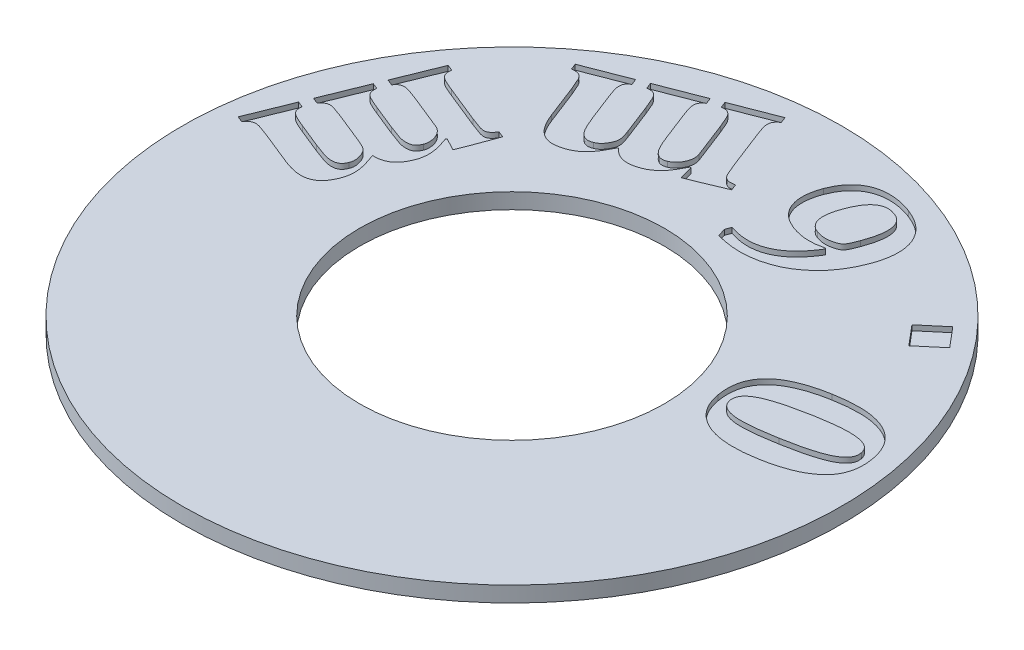
from build123d import *

# Parameters (mm, degrees)
SKETCH1_R           = 12.7
BOSS_EXTRUDE1_DEPTH = 0.6
SKETCH2_R           = 5.8674
CUT_EXTRUDE1_DEPTH  = 18.970531433
CUT_EXTRUDE2_DEPTH  = 0.2


with BuildPart() as part:
    # Sketch1 → Boss-Extrude1 (new body)
    with BuildSketch(Plane(origin=(0, 0, 0), x_dir=(1, 0, 0), z_dir=(0, 1, 0))):
        with Locations(Location((0, 0, 0), (0, 0, 270))):
            Circle(SKETCH1_R)
    extrude(amount=BOSS_EXTRUDE1_DEPTH)

    # Sketch2 → Cut-Extrude1 (cut, through all)
    with BuildSketch(Plane(origin=(0, 0, 0), x_dir=(-1, 0, 0), z_dir=(0, -1, 0))):
        with Locations(Location((0, 0, 0), (0, 0, 90))):
            Circle(SKETCH2_R)
    extrude(amount=-CUT_EXTRUDE1_DEPTH, mode=Mode.SUBTRACT)

    # Sketch4 → Cut-Extrude2 (cut)
    # profile 1 of 5: a face of its own
    with BuildSketch(Plane(origin=(0, 0.6, 0), x_dir=(1, 0, 0), z_dir=(0, 1, 0))):
        with BuildLine():
            add(Edge.make_bspline(
                [(11.714406882, 2.179505208), (11.721984598, 2.132914268), (11.736908331, 2.041156981), (11.74866318, 1.904864997), (11.752357826, 1.773036451), (11.746695803, 1.645600384), (11.733179819, 1.522296204), (11.707876126, 1.403581433), (11.676714797, 1.28899405), (11.635405668, 1.178658558), (11.584646929, 1.072709619), (11.523881673, 0.970485095), (11.450986751, 0.873052683), (11.368678714, 0.778083972), (11.274465946, 0.687951638), (11.170133167, 0.601476878), (11.055210203, 0.519203927), (10.930428021, 0.43948966), (10.794467406, 0.364166051), (10.646314632, 0.29538558), (10.487102545, 0.230047996), (10.316218188, 0.16993316), (10.134333462, 0.113455876), (9.940675548, 0.063162279), (9.735895278, 0.016742244), (9.594894738, -0.009651177), (9.522774937, -0.023151042)],
                knots=[0, 0, 0, 0, 0.958609587, 1.887908131, 2.776528707, 3.635817958, 4.477514347, 5.292981102, 6.098962166, 6.887927691, 7.682593858, 8.482745968, 9.299441865, 10.151273195, 11.03293693, 11.944771076, 12.90195535, 13.902185533, 14.951360626, 16.056714254, 17.218407893, 18.446172401, 19.735398079, 21.086155649, 22.509609453, 24, 24, 24, 24], degree=3))
            add(Edge.make_bspline(
                [(9.522774937, -0.023151042), (9.454127441, -0.034645174), (9.319705933, -0.05715231), (9.12075356, -0.082313288), (8.928870131, -0.100575903), (8.743451731, -0.10917171), (8.565078925, -0.110415714), (8.393576185, -0.104321059), (8.229124035, -0.088644407), (8.071591119, -0.065721648), (7.920831055, -0.035182887), (7.778159776, 0.00463669), (7.642571789, 0.051083117), (7.514219242, 0.104586405), (7.394291447, 0.168004545), (7.280576129, 0.23747752), (7.175347658, 0.315612752), (7.077398468, 0.400919375), (6.98835329, 0.493963148), (6.905829407, 0.592845125), (6.834554273, 0.700823489), (6.770493783, 0.814664857), (6.713621981, 0.934727323), (6.668112162, 1.062488935), (6.628452618, 1.196237051), (6.610486777, 1.288925244), (6.601333965, 1.336145833)],
                knots=[0, 0, 0, 0, 1.377081801, 2.696520979, 3.967029936, 5.189958886, 6.367899492, 7.495764028, 8.58392972, 9.634848915, 10.644458858, 11.625276047, 12.563445176, 13.479055366, 14.373430196, 15.245143787, 16.113332587, 16.963553947, 17.81203241, 18.65923255, 19.508240485, 20.36773861, 21.24275135, 22.132948981, 23.048818972, 24, 24, 24, 24], degree=3))
            add(Edge.make_bspline(
                [(6.601333965, 1.336145833), (6.590374917, 1.409119309), (6.569088165, 1.550862297), (6.561219532, 1.760415475), (6.575293668, 1.958953541), (6.610358421, 2.147139956), (6.667456922, 2.324628611), (6.748320425, 2.490485464), (6.849085657, 2.646203705), (6.972869034, 2.79037078), (7.119030215, 2.923495287), (7.287908697, 3.046015147), (7.479575957, 3.15799777), (7.692999529, 3.260534562), (7.929473846, 3.351911703), (8.188606749, 3.432493305), (8.469955143, 3.504792325), (8.666309681, 3.541772454), (8.767610007, 3.560850694)],
                knots=[0, 0, 0, 0, 0.999567856, 1.941551137, 2.835430862, 3.692112604, 4.530042397, 5.354256606, 6.185901446, 7.037296772, 7.922125271, 8.859554852, 9.859817352, 10.926857119, 12.065428116, 13.292532894, 14.603203662, 16, 16, 16, 16], degree=3))
            add(Edge.make_bspline(
                [(8.767610007, 3.560850694), (8.872556173, 3.578089573), (9.075950462, 3.611499934), (9.374044021, 3.642534882), (9.654962104, 3.655480481), (9.919104507, 3.649083388), (10.16646075, 3.625396611), (10.396947804, 3.584262386), (10.610223933, 3.523655106), (10.806244942, 3.444326865), (10.984715177, 3.347232526), (11.145299598, 3.232771229), (11.287704723, 3.100868546), (11.410870941, 2.950264084), (11.516398778, 2.782666511), (11.602055143, 2.597212453), (11.670170403, 2.3949462), (11.699387738, 2.252651608), (11.714406882, 2.179505208)],
                knots=[0, 0, 0, 0, 1.382354807, 2.679117153, 3.893664334, 5.035775843, 6.111018257, 7.121123013, 8.075237234, 8.98808331, 9.864605882, 10.710386895, 11.545304963, 12.380236698, 13.232482408, 14.113005489, 15.02999227, 16, 16, 16, 16], degree=3))
        make_face()
        with BuildLine():
            add(Edge.make_bspline(
                [(9.219606535, 1.068255208), (9.284683323, 1.079829663), (9.411704072, 1.102421373), (9.596640597, 1.138497503), (9.770534016, 1.176660884), (9.934053566, 1.212252427), (10.086559049, 1.249921426), (10.228376129, 1.288387015), (10.35990895, 1.327142151), (10.481497289, 1.365270741), (10.593486227, 1.40541221), (10.697010143, 1.445743704), (10.79215177, 1.48792763), (10.87901414, 1.530180936), (10.957341787, 1.574928103), (11.027127581, 1.620793229), (11.089596263, 1.666885144), (11.158879658, 1.728964171), (11.22971171, 1.810928632), (11.284648099, 1.922689244), (11.309871915, 2.043155021), (11.300339469, 2.123992073), (11.295483271, 2.165173611)],
                knots=[0, 0, 0, 0, 1.557617706, 3.040250939, 4.439806625, 5.752917555, 6.983694298, 8.141184335, 9.215338113, 10.214963335, 11.143493169, 12.018295842, 12.832493275, 13.595433329, 14.293601868, 14.956508562, 15.562688609, 16.120753321, 17.14746835, 18.092449204, 19.02821946, 20, 20, 20, 20], degree=3))
            add(Edge.make_bspline(
                [(11.295483271, 2.165173611), (11.290630428, 2.187423295), (11.281129519, 2.230983781), (11.255962542, 2.291754108), (11.225759764, 2.348181119), (11.184496682, 2.39690216), (11.137027399, 2.441883073), (11.0791213, 2.480383085), (11.013344364, 2.515872768), (10.937047568, 2.544976214), (10.851936991, 2.572052153), (10.75519068, 2.592541648), (10.647257078, 2.607613076), (10.527627319, 2.617369926), (10.395573233, 2.621273708), (10.249846914, 2.620975218), (10.090001592, 2.60947772), (9.916856706, 2.594438819), (9.731964111, 2.573380479), (9.53727306, 2.546553163), (9.33246291, 2.515932739), (9.193101759, 2.491778247), (9.121490215, 2.479366319)],
                knots=[0, 0, 0, 0, 0.572229672, 1.120312679, 1.650532829, 2.176538382, 2.719915381, 3.292219849, 3.921383417, 4.598328246, 5.344567867, 6.168499634, 7.084441038, 8.087164471, 9.188822549, 10.410175109, 11.7543557, 13.221963368, 14.786276719, 16.438938668, 18.170127758, 20, 20, 20, 20], degree=3))
            add(Edge.make_bspline(
                [(9.121490215, 2.479366319), (9.017037789, 2.459976007), (8.816564112, 2.422760526), (8.530215213, 2.362148612), (8.270747284, 2.301187922), (8.038791019, 2.23725447), (7.833636719, 2.172384552), (7.654402583, 2.108053279), (7.501513369, 2.042603377), (7.374408119, 1.975163143), (7.26992064, 1.906849976), (7.183532145, 1.838824888), (7.115875961, 1.768140381), (7.064031908, 1.69661103), (7.030638119, 1.621986877), (7.010354212, 1.545727996), (7.002907456, 1.466434944), (7.010030296, 1.413636803), (7.013642993, 1.386857639)],
                knots=[0, 0, 0, 0, 1.988775594, 3.817021521, 5.4789669, 6.977745736, 8.32016058, 9.506246951, 10.541465291, 11.430941948, 12.196080763, 12.876175374, 13.484416021, 14.022644376, 14.521394553, 15.005310829, 15.495494642, 16, 16, 16, 16], degree=3))
            add(Edge.make_bspline(
                [(7.013642993, 1.386857639), (7.020973001, 1.355992341), (7.03519293, 1.29611487), (7.075179093, 1.213190212), (7.129685771, 1.140706797), (7.200039193, 1.078925458), (7.285376056, 1.02810536), (7.385532945, 0.987763871), (7.500413136, 0.957375034), (7.629962099, 0.935883122), (7.775133078, 0.922664936), (7.93566621, 0.920645981), (8.111495262, 0.92477074), (8.302288999, 0.938796755), (8.508870696, 0.959906252), (8.731603074, 0.988816652), (8.970430894, 1.025365971), (9.134764463, 1.053651808), (9.219606535, 1.068255208)],
                knots=[0, 0, 0, 0, 0.626844687, 1.216054204, 1.808491308, 2.41169403, 3.058255876, 3.766476537, 4.543323699, 5.407210063, 6.364629713, 7.427452982, 8.585033063, 9.847165452, 11.215172558, 12.697471874, 14.294972063, 16, 16, 16, 16], degree=3))
        make_face(mode=Mode.SUBTRACT)
    # profile 2 of 5: a face of its own
    with BuildSketch(Plane(origin=(0, 0.6, 0), x_dir=(1, 0, 0), z_dir=(0, 1, 0))):
        Polygon((7.998334498, 7.413598887), (8.851615748, 8.134588471), (9.493230331, 7.375013818), (8.639949081, 6.654024235), align=None)
    # profile 3 of 5: a face of its own
    with BuildSketch(Plane(origin=(0, 0.6, 0), x_dir=(1, 0, 0), z_dir=(0, 1, 0))):
        with BuildLine():
            Line((1.200452366, 6.983777969), (1.280929797, 7.199854358))
            add(Edge.make_bspline(
                [(1.280929797, 7.199854358), (1.343817795, 7.179261353), (1.467155686, 7.138873713), (1.654011169, 7.098413309), (1.836977253, 7.07493453), (2.015597423, 7.068035969), (2.190562747, 7.078072145), (2.361694864, 7.104178741), (2.529159758, 7.148459834), (2.691452106, 7.211129672), (2.849876645, 7.288087424), (3.00262888, 7.382899312), (3.150358517, 7.492976917), (3.291751018, 7.620066885), (3.42880272, 7.760899591), (3.558935253, 7.919039208), (3.685331048, 8.091932582), (3.761884595, 8.216465585), (3.801086047, 8.280236302)],
                knots=[0, 0, 0, 0, 1.055048788, 2.0691944, 3.044229261, 3.994526873, 4.916374231, 5.835814113, 6.751508959, 7.673635849, 8.606948974, 9.557047682, 10.537179467, 11.541963796, 12.586653235, 13.668953384, 14.806320344, 16, 16, 16, 16], degree=3))
            Line((3.801086047, 8.280236302), (3.770217991, 8.307797066))
            add(Edge.make_bspline(
                [(3.770217991, 8.307797066), (3.71414798, 8.294562398), (3.604496336, 8.268680414), (3.440218512, 8.243045281), (3.280238818, 8.230703616), (3.12312468, 8.231653016), (2.966792107, 8.24638583), (2.809094217, 8.274242223), (2.648638057, 8.314787763), (2.542955388, 8.351804744), (2.489193686, 8.370635608)],
                knots=[0, 0, 0, 0, 1.05963004, 2.072233846, 3.055361679, 4.0086536, 4.959232627, 5.940685308, 6.95240852, 8, 8, 8, 8], degree=3))
            add(Edge.make_bspline(
                [(2.489193686, 8.370635608), (2.425678851, 8.396737335), (2.302249784, 8.447461105), (2.132920474, 8.545831273), (1.986886121, 8.662813599), (1.863257967, 8.795473288), (1.764751057, 8.943805026), (1.688468588, 9.103519705), (1.639308535, 9.275732636), (1.612688242, 9.457753868), (1.611225732, 9.648604645), (1.633351871, 9.846131474), (1.675600618, 10.050562667), (1.722178032, 10.185318726), (1.746155491, 10.254689427)],
                knots=[0, 0, 0, 0, 1.077595584, 2.094103196, 3.062986482, 4.006354381, 4.929902502, 5.848931818, 6.774838988, 7.731371815, 8.729829957, 9.762912156, 10.848375697, 12, 12, 12, 12], degree=3))
            add(Edge.make_bspline(
                [(1.746155491, 10.254689427), (1.7763527, 10.329017713), (1.835212514, 10.473896968), (1.951299256, 10.672660048), (2.085665588, 10.848945539), (2.213804547, 10.97741434), (2.326332688, 11.065860187), (2.414590439, 11.126148678), (2.508811454, 11.177493313), (2.606907441, 11.223070875), (2.710126865, 11.260830416), (2.818355474, 11.290046763), (2.930920772, 11.313549546), (3.048111242, 11.328816613), (3.169265694, 11.336319095), (3.294130713, 11.336644782), (3.422555278, 11.327106532), (3.55443731, 11.311041992), (3.689828281, 11.285147679), (3.828062677, 11.250881114), (3.970010998, 11.208775039), (4.064699677, 11.175620405), (4.113073894, 11.158682483)],
                knots=[0, 0, 0, 0, 1.672877526, 3.260740491, 4.787171376, 6.289516588, 7.032212332, 7.772527889, 8.517517252, 9.269110702, 10.028607479, 10.808285605, 11.607046719, 12.427139982, 13.272559756, 14.139283271, 15.03113053, 15.958707747, 16.910946222, 17.906201506, 18.93032764, 20, 20, 20, 20], degree=3))
            add(Edge.make_bspline(
                [(4.113073894, 11.158682483), (4.15697111, 11.141450954), (4.243422618, 11.107515052), (4.368170705, 11.050419534), (4.484996173, 10.987386071), (4.59493391, 10.920003123), (4.697245283, 10.847353308), (4.79277647, 10.769806838), (4.880831456, 10.687287685), (4.961582993, 10.600024174), (5.034609675, 10.508303615), (5.099779246, 10.41208411), (5.157520331, 10.31176066), (5.205939239, 10.20638206), (5.246771826, 10.09693552), (5.280219809, 9.983207721), (5.303980564, 9.864730901), (5.320880501, 9.742517717), (5.328043678, 9.616488704), (5.328305305, 9.48689334), (5.319416583, 9.353933132), (5.301199014, 9.21787529), (5.276088854, 9.078654194), (5.241524935, 8.936320611), (5.198718022, 8.790527437), (5.163826853, 8.693479882), (5.146051325, 8.644038385)],
                knots=[0, 0, 0, 0, 1.098191461, 2.162786548, 3.192832132, 4.188048845, 5.164054587, 6.113082797, 7.051594597, 7.972179555, 8.879742853, 9.779402692, 10.67641257, 11.572442019, 12.476973698, 13.395128669, 14.330043427, 15.288670823, 16.266176383, 17.267519822, 18.30535816, 19.36692158, 20.463110258, 21.598586896, 22.776584751, 24, 24, 24, 24], degree=3))
            add(Edge.make_bspline(
                [(5.146051325, 8.644038385), (5.120410458, 8.577547881), (5.069504659, 8.445541726), (4.979642143, 8.255748764), (4.882591907, 8.073477), (4.7757546, 7.901071263), (4.66050112, 7.736651354), (4.536347737, 7.581334242), (4.401952184, 7.435476143), (4.260695193, 7.298015339), (4.111468893, 7.171081941), (3.956153925, 7.054726669), (3.793202875, 6.951568523), (3.625965791, 6.857262903), (3.452169721, 6.775166977), (3.271848517, 6.706482366), (3.086418619, 6.645984938), (2.895066533, 6.599208672), (2.700286371, 6.564048118), (2.50372428, 6.540540621), (2.305560774, 6.530620344), (2.106360141, 6.534210416), (1.905755587, 6.549850704), (1.704278713, 6.57711169), (1.501495309, 6.618153508), (1.367468793, 6.65450437), (1.299671116, 6.672892552)],
                knots=[0, 0, 0, 0, 1.070823632, 2.125947334, 3.153976389, 4.173332704, 5.172465224, 6.170528418, 7.159609897, 8.15178657, 9.131336938, 10.102378564, 11.066150857, 12.028085339, 12.986779263, 13.952022445, 14.926733186, 15.916739616, 16.91025301, 17.90025944, 18.890219644, 19.890115268, 20.892859756, 21.913053768, 22.944312598, 24, 24, 24, 24], degree=3))
            Line((1.299671116, 6.672892552), (1.200452366, 6.983777969))
        make_face()
        with BuildLine():
            add(Edge.make_bspline(
                [(3.076789172, 8.698057483), (3.132909456, 8.679932439), (3.243010075, 8.644373488), (3.413032857, 8.625283629), (3.576075832, 8.63331494), (3.704133547, 8.658205157), (3.795432605, 8.686357261), (3.852529709, 8.707316756), (3.898519111, 8.728016151), (3.948692476, 8.75488002), (4.001805532, 8.805818747), (4.047266948, 8.872729684), (4.084461884, 8.946478634), (4.119923668, 9.023856133), (4.158569665, 9.121872517), (4.186258552, 9.19376456), (4.201268339, 9.232736302)],
                knots=[0, 0, 0, 0, 1.710541778, 3.355858038, 4.938271646, 6.440062148, 7.13262002, 7.713873542, 8.206199276, 8.598318393, 9.361997601, 10.313061428, 10.938824559, 11.760841173, 12.786181087, 14, 14, 14, 14], degree=3))
            add(Edge.make_bspline(
                [(4.201268339, 9.232736302), (4.219616657, 9.284432015), (4.255072374, 9.384327197), (4.30105685, 9.531510269), (4.335960436, 9.671161482), (4.362974871, 9.803145166), (4.381080853, 9.927152769), (4.388903885, 10.043638718), (4.388039482, 10.152006568), (4.378848483, 10.252989558), (4.358648581, 10.346021304), (4.330820471, 10.43180026), (4.290949714, 10.508625418), (4.24422561, 10.579514316), (4.184064175, 10.639885789), (4.116891173, 10.694879513), (4.038769365, 10.7401109), (3.982187335, 10.763211055), (3.953221464, 10.775036649)],
                knots=[0, 0, 0, 0, 1.500894568, 2.900281813, 4.217152542, 5.437764563, 6.585289063, 7.643385764, 8.628806701, 9.548256839, 10.412033135, 11.229197673, 12.007129352, 12.774066827, 13.542058149, 14.328777375, 15.144455933, 16, 16, 16, 16], degree=3))
            add(Edge.make_bspline(
                [(3.953221464, 10.775036649), (3.919245977, 10.786364872), (3.853943728, 10.80813817), (3.75608292, 10.828911875), (3.662442482, 10.834694319), (3.573482634, 10.826592591), (3.488865702, 10.807977138), (3.408458099, 10.777657234), (3.332269753, 10.736631897), (3.260047544, 10.685155263), (3.191439608, 10.624053207), (3.126309215, 10.552989981), (3.064446481, 10.472120724), (2.985796284, 10.348662157), (2.892809985, 10.174619164), (2.834135004, 10.024617309), (2.803386394, 9.946008871)],
                knots=[0, 0, 0, 0, 0.932873925, 1.793021151, 2.598839487, 3.367856657, 4.113627244, 4.849993345, 5.599749579, 6.36230028, 7.155964143, 7.989527263, 8.87058289, 9.805567893, 11.801908814, 14, 14, 14, 14], degree=3))
            add(Edge.make_bspline(
                [(2.803386394, 9.946008871), (2.789021343, 9.905717802), (2.761142699, 9.82752383), (2.727163126, 9.711565588), (2.69985937, 9.601384176), (2.682829992, 9.496212874), (2.670852833, 9.39695612), (2.668292805, 9.303160591), (2.675472645, 9.215066626), (2.688060026, 9.132630092), (2.708521729, 9.055609287), (2.739278462, 8.985918652), (2.775041981, 8.920834938), (2.820963864, 8.863655968), (2.873499986, 8.812178352), (2.933526127, 8.766434912), (3.002012742, 8.728007435), (3.051553194, 8.708165164), (3.076789172, 8.698057483)],
                knots=[0, 0, 0, 0, 1.424088551, 2.763767271, 4.022183305, 5.201039714, 6.30911801, 7.349523498, 8.319005133, 9.248428938, 10.124185317, 10.962911168, 11.779474492, 12.589779123, 13.394520957, 14.224182145, 15.095395788, 16, 16, 16, 16], degree=3))
        make_face(mode=Mode.SUBTRACT)
    # profile 4 of 5: a face of its own
    with BuildSketch(Plane(origin=(0, 0.6, 0), x_dir=(1, 0, 0), z_dir=(0, 1, 0))):
        with BuildLine():
            Line((-1.500499582, 8.398806621), (-1.545699235, 8.394396899))
            add(Edge.make_bspline(
                [(-1.545699235, 8.394396899), (-1.578680129, 8.328177935), (-1.64156419, 8.201919461), (-1.744030648, 8.02884167), (-1.846044886, 7.880084841), (-1.949946333, 7.754727011), (-2.05857315, 7.650318657), (-2.17357881, 7.562688436), (-2.294646542, 7.48709386), (-2.38188138, 7.450331118), (-2.425438818, 7.431975024)],
                knots=[0, 0, 0, 0, 1.327248858, 2.530640849, 3.606312378, 4.561298934, 5.447501221, 6.30354898, 7.15294094, 8, 8, 8, 8], degree=3))
            add(Edge.make_bspline(
                [(-2.425438818, 7.431975024), (-2.466711164, 7.416501822), (-2.546064862, 7.386751738), (-2.664025189, 7.356362389), (-2.774202536, 7.336715383), (-2.877415506, 7.329477021), (-2.975012839, 7.335492968), (-3.068194376, 7.350780271), (-3.158059284, 7.376341345), (-3.244768044, 7.411813357), (-3.328951411, 7.458526601), (-3.408552551, 7.519497131), (-3.489562903, 7.588502591), (-3.538054885, 7.643001758), (-3.563147151, 7.671202454)],
                knots=[0, 0, 0, 0, 1.261849166, 2.426137807, 3.483538902, 4.464561663, 5.381899843, 6.278343648, 7.164718223, 8.052217243, 8.957088943, 9.91293841, 10.920046081, 12, 12, 12, 12], degree=3))
            add(Edge.make_bspline(
                [(-3.563147151, 7.671202454), (-3.599531182, 7.59843004), (-3.668389116, 7.460705936), (-3.777147706, 7.27123298), (-3.885029972, 7.111206789), (-3.99057811, 6.976050247), (-4.102053829, 6.86480688), (-4.219976724, 6.770641123), (-4.348199055, 6.69203994), (-4.439779694, 6.652578048), (-4.485881526, 6.632712871)],
                knots=[0, 0, 0, 0, 1.370148351, 2.593049264, 3.676206861, 4.618613109, 5.476374145, 6.322127868, 7.155356622, 8, 8, 8, 8], degree=3))
            add(Edge.make_bspline(
                [(-4.485881526, 6.632712871), (-4.530445251, 6.616076964), (-4.615952839, 6.584156465), (-4.743101562, 6.551526654), (-4.861772979, 6.530294812), (-4.973189572, 6.524827778), (-5.078684173, 6.531644554), (-5.178538203, 6.555233414), (-5.275449977, 6.587065021), (-5.366578661, 6.635862424), (-5.452894115, 6.696968271), (-5.534744327, 6.770753064), (-5.613569564, 6.855921676), (-5.687290851, 6.95508305), (-5.757960734, 7.067347228), (-5.826043906, 7.19293182), (-5.891036555, 7.332819596), (-5.93122393, 7.431428083), (-5.952114165, 7.482686829)],
                knots=[0, 0, 0, 0, 1.164238848, 2.233907847, 3.210467445, 4.111618036, 4.95998529, 5.789768502, 6.618037198, 7.451375979, 8.310370773, 9.20280479, 10.145472204, 11.148103074, 12.224265042, 13.392220349, 14.64442181, 16, 16, 16, 16], degree=3))
            Line((-5.952114165, 7.482686829), (-6.443798193, 8.752686829))
            add(Edge.make_bspline(
                [(-6.443798193, 8.752686829), (-6.46298886, 8.80204742), (-6.500138469, 8.897600464), (-6.557518406, 9.031550001), (-6.610596713, 9.14701544), (-6.6652213, 9.236719574), (-6.719195792, 9.30301382), (-6.776882541, 9.349899558), (-6.841998121, 9.381410269), (-6.91741995, 9.396764093), (-7.003583166, 9.400735532), (-7.06413052, 9.395102303), (-7.096437082, 9.392096552)],
                knots=[0, 0, 0, 0, 1.559140996, 3.018210822, 4.290952874, 5.296787436, 6.103062558, 6.795868098, 7.468525882, 8.211398264, 9.045646607, 10, 10, 10, 10], degree=3))
            Line((-7.096437082, 9.392096552), (-7.185733957, 9.621402107))
            Line((-7.185733957, 9.621402107), (-5.508937082, 10.271836135))
            Line((-5.508937082, 10.271836135), (-5.419640207, 10.042530579))
            add(Edge.make_bspline(
                [(-5.419640207, 10.042530579), (-5.44126826, 10.026399982), (-5.481650493, 9.996282175), (-5.533846741, 9.947929725), (-5.570951767, 9.898212078), (-5.594627254, 9.847372575), (-5.604920024, 9.794555745), (-5.609329846, 9.738344691), (-5.607052869, 9.676900081), (-5.596124222, 9.607106489), (-5.574701737, 9.523170129), (-5.540686924, 9.418742082), (-5.495430219, 9.289738424), (-5.459929128, 9.196145913), (-5.440586387, 9.145152107)],
                knots=[0, 0, 0, 0, 0.976263073, 1.822803084, 2.564919562, 3.207680077, 3.833713685, 4.500778585, 5.245986733, 6.052842077, 7.052732165, 8.377616694, 10.026347317, 12, 12, 12, 12], degree=3))
            Line((-5.440586387, 9.145152107), (-5.077886735, 8.212495857))
            add(Edge.make_bspline(
                [(-5.077886735, 8.212495857), (-5.058213378, 8.162818328), (-5.020773209, 8.068277516), (-4.964958774, 7.935032266), (-4.911566849, 7.817607376), (-4.862407323, 7.714442109), (-4.814206633, 7.625009471), (-4.764214553, 7.549826783), (-4.714948421, 7.485912263), (-4.663879121, 7.434812521), (-4.612373766, 7.394089192), (-4.560879865, 7.363706829), (-4.510177119, 7.340304693), (-4.45834347, 7.326789669), (-4.404290481, 7.322415505), (-4.347102358, 7.327322637), (-4.286499427, 7.340839251), (-4.245784961, 7.355102318), (-4.224605485, 7.362521899)],
                knots=[0, 0, 0, 0, 1.886072366, 3.589365554, 5.098767554, 6.438935382, 7.62327005, 8.680997452, 9.623029443, 10.466885591, 11.224590498, 11.934248244, 12.573028465, 13.189694188, 13.814492117, 14.478078476, 15.208303495, 16, 16, 16, 16], degree=3))
            add(Edge.make_bspline(
                [(-4.224605485, 7.362521899), (-4.196124879, 7.375107043), (-4.140617846, 7.399634753), (-4.06647594, 7.453951996), (-4.002096369, 7.521299194), (-3.946506985, 7.600529328), (-3.897145713, 7.683379182), (-3.857845601, 7.766968153), (-3.829112457, 7.850147785), (-3.819086508, 7.936966256), (-3.820853325, 8.026934807), (-3.836167036, 8.105507556), (-3.855045624, 8.176985637), (-3.877649694, 8.244743013), (-3.906253353, 8.326857924), (-3.92895999, 8.385647919), (-3.941280832, 8.41754794)],
                knots=[0, 0, 0, 0, 1.05712718, 2.060278967, 3.103930472, 4.214663213, 5.347149753, 6.382223774, 7.355140304, 8.326206341, 9.339519046, 10.406659634, 11.040664636, 11.855394827, 12.836316401, 14, 14, 14, 14], degree=3))
            Line((-3.941280832, 8.41754794), (-4.381150624, 9.551948982))
            add(Edge.make_bspline(
                [(-4.381150624, 9.551948982), (-4.395843684, 9.589066049), (-4.42322045, 9.65822422), (-4.461713942, 9.755215287), (-4.496936471, 9.837422587), (-4.535923805, 9.924848545), (-4.581174005, 10.013011645), (-4.639853073, 10.097027896), (-4.70584835, 10.158300648), (-4.770957186, 10.189348355), (-4.82925529, 10.203846904), (-4.881158179, 10.209027832), (-4.940539071, 10.208514609), (-4.982726237, 10.205229651), (-5.005126318, 10.20348544)],
                knots=[0, 0, 0, 0, 1.43593228, 2.675492938, 3.753329024, 4.652559938, 6.11901344, 7.311444819, 8.322447917, 9.321542641, 9.866545793, 10.478167495, 11.191953967, 12, 12, 12, 12], degree=3))
            Line((-5.005126318, 10.20348544), (-5.094423193, 10.432790996))
            Line((-5.094423193, 10.432790996), (-3.438572499, 11.074405579))
            Line((-3.438572499, 11.074405579), (-3.349275624, 10.845100024))
            add(Edge.make_bspline(
                [(-3.349275624, 10.845100024), (-3.371829284, 10.829185098), (-3.413734166, 10.799615038), (-3.465251913, 10.749034653), (-3.503876703, 10.69980329), (-3.528520914, 10.648919497), (-3.540482433, 10.595811986), (-3.544340482, 10.539416273), (-3.542185737, 10.47838512), (-3.531505961, 10.409501208), (-3.508063178, 10.326746257), (-3.474739068, 10.222065038), (-3.429638126, 10.092106636), (-3.393324208, 9.997946719), (-3.373529096, 9.946619121)],
                knots=[0, 0, 0, 0, 0.992957471, 1.844922954, 2.591631667, 3.237113429, 3.86329802, 4.54058269, 5.269232777, 6.059395145, 7.045266299, 8.364235463, 10.018105088, 12, 12, 12, 12], degree=3))
            Line((-3.373529096, 9.946619121), (-3.010829443, 9.013962871))
            add(Edge.make_bspline(
                [(-3.010829443, 9.013962871), (-2.996657788, 8.977151092), (-2.969516159, 8.906648973), (-2.928004225, 8.806398578), (-2.891454916, 8.714556702), (-2.844654724, 8.610739499), (-2.791764113, 8.500780224), (-2.730333993, 8.390242101), (-2.666711658, 8.305624809), (-2.604799685, 8.236574129), (-2.538315851, 8.186697449), (-2.473039115, 8.148601797), (-2.403922676, 8.128561555), (-2.329787806, 8.121444181), (-2.246708712, 8.132336889), (-2.1910254, 8.152150967), (-2.160855485, 8.162886482)],
                knots=[0, 0, 0, 0, 1.218376668, 2.33344156, 3.351562828, 4.271279059, 5.850097088, 7.121466675, 8.168044415, 9.115705124, 9.973893436, 10.725810247, 11.436861629, 12.177817345, 13.012718608, 14, 14, 14, 14], degree=3))
            add(Edge.make_bspline(
                [(-2.160855485, 8.162886482), (-2.139651487, 8.17267279), (-2.096037015, 8.192802233), (-2.034047516, 8.233544001), (-1.97680789, 8.28717359), (-1.920611109, 8.347803533), (-1.870920225, 8.417558281), (-1.828079155, 8.49341736), (-1.795216046, 8.575437602), (-1.771331247, 8.661942034), (-1.756280888, 8.749896331), (-1.755281747, 8.83758026), (-1.766801807, 8.92340652), (-1.78547311, 8.977820506), (-1.79484854, 9.005143427)],
                knots=[0, 0, 0, 0, 0.836243377, 1.720067758, 2.64304706, 3.640427864, 4.67827718, 5.704026804, 6.755486752, 7.835339964, 8.915594534, 9.942780013, 10.967007125, 12, 12, 12, 12], degree=3))
            Line((-1.79484854, 9.005143427), (-2.317400624, 10.352313565))
            add(Edge.make_bspline(
                [(-2.317400624, 10.352313565), (-2.337449883, 10.40272207), (-2.374297839, 10.495366407), (-2.426816724, 10.620893065), (-2.471793057, 10.720796935), (-2.510807835, 10.798084427), (-2.54947846, 10.857414013), (-2.587241421, 10.906814316), (-2.629873376, 10.945553523), (-2.675175925, 10.977219168), (-2.728120542, 10.998709343), (-2.789785301, 11.010093904), (-2.861054931, 11.0134522), (-2.911278956, 11.00790917), (-2.938069026, 11.004952454)],
                knots=[0, 0, 0, 0, 1.95560344, 3.594147164, 4.904245662, 5.905587673, 6.710271926, 7.455046029, 8.139409163, 8.778697916, 9.437986146, 10.180991047, 11.02971977, 12, 12, 12, 12], degree=3))
            Line((-2.938069026, 11.004952454), (-3.027365901, 11.23425801))
            Line((-3.027365901, 11.23425801), (-1.360490901, 11.880282315))
            Line((-1.360490901, 11.880282315), (-1.271194026, 11.65097676))
            add(Edge.make_bspline(
                [(-1.271194026, 11.65097676), (-1.294464177, 11.633544837), (-1.337723243, 11.601139), (-1.391337788, 11.547318124), (-1.431986317, 11.49598486), (-1.45922466, 11.443955182), (-1.473163029, 11.3904295), (-1.479948266, 11.334042404), (-1.478351478, 11.2732882), (-1.469043519, 11.204391579), (-1.446753676, 11.121913989), (-1.414774149, 11.018105936), (-1.368617134, 10.890236847), (-1.333428141, 10.796908086), (-1.314188818, 10.745881274)],
                knots=[0, 0, 0, 0, 1.037135948, 1.928029266, 2.705015774, 3.368269828, 4.008263075, 4.669175765, 5.391120458, 6.172527977, 7.146544743, 8.437585155, 10.052275959, 12, 12, 12, 12], degree=3))
            Line((-1.314188818, 10.745881274), (-0.759666249, 9.316028843))
            add(Edge.make_bspline(
                [(-0.759666249, 9.316028843), (-0.743921112, 9.275951927), (-0.714551879, 9.201196888), (-0.672985784, 9.097792191), (-0.636647661, 9.011772902), (-0.597587967, 8.923591054), (-0.551084166, 8.837162329), (-0.490114353, 8.754815403), (-0.417614899, 8.699473063), (-0.347881536, 8.672373402), (-0.282522669, 8.66399496), (-0.221567487, 8.665129956), (-0.1486079, 8.670552639), (-0.096688113, 8.678765615), (-0.06844229, 8.683233704)],
                knots=[0, 0, 0, 0, 1.450579982, 2.705751189, 3.754223165, 4.596399602, 5.953928095, 7.055990142, 8.019135306, 8.987042258, 9.536785458, 10.230042737, 11.037093544, 12, 12, 12, 12], degree=3))
            Line((-0.06844229, 8.683233704), (0.023059446, 8.446211135))
            Line((0.023059446, 8.446211135), (-0.919518679, 8.048233704))
            Line((-0.919518679, 8.048233704), (-1.35828604, 7.878459399))
            Line((-1.35828604, 7.878459399), (-1.500499582, 8.398806621))
        make_face()
    # profile 5 of 5: a face of its own
    with BuildSketch(Plane(origin=(0, 0.6, 0), x_dir=(1, 0, 0), z_dir=(0, 1, 0))):
        with BuildLine():
            Line((-7.16368149, 4.664663168), (-7.190139823, 4.626078099))
            add(Edge.make_bspline(
                [(-7.190139823, 4.626078099), (-7.164649314, 4.55729115), (-7.116159018, 4.42643855), (-7.060406274, 4.234988301), (-7.023567353, 4.059884896), (-7.00352064, 3.899037183), (-7.001186545, 3.748971413), (-7.014304824, 3.605121185), (-7.043445696, 3.465714205), (-7.075877359, 3.377062447), (-7.092023504, 3.332927057)],
                knots=[0, 0, 0, 0, 1.323655474, 2.517974168, 3.594956346, 4.550030047, 5.438835311, 6.298074595, 7.15269428, 8, 8, 8, 8], degree=3))
            add(Edge.make_bspline(
                [(-7.092023504, 3.332927057), (-7.109391964, 3.292567879), (-7.142627793, 3.215337616), (-7.200539997, 3.109008476), (-7.260487173, 3.015474937), (-7.326239511, 2.936063699), (-7.396981172, 2.869399843), (-7.470867554, 2.811013651), (-7.551013684, 2.763937143), (-7.6355474, 2.724328503), (-7.72676892, 2.695727303), (-7.825186481, 2.677359214), (-7.930758256, 2.667037872), (-8.00371313, 2.668508086), (-8.041216212, 2.669263863)],
                knots=[0, 0, 0, 0, 1.263710982, 2.418204165, 3.479912074, 4.456078823, 5.37604635, 6.272872525, 7.159668175, 8.044444074, 8.954083143, 9.901829511, 10.921417382, 12, 12, 12, 12], degree=3))
            add(Edge.make_bspline(
                [(-8.041216212, 2.669263863), (-8.012664087, 2.593533847), (-7.958672874, 2.450330655), (-7.897254148, 2.242338044), (-7.85254913, 2.055967161), (-7.828474389, 1.886937938), (-7.821582298, 1.730088367), (-7.835967702, 1.580047311), (-7.864362196, 1.433331711), (-7.898467654, 1.340098421), (-7.915539129, 1.293430529)],
                knots=[0, 0, 0, 0, 1.370034684, 2.590694547, 3.669965494, 4.612469718, 5.477980982, 6.321354364, 7.159754493, 8, 8, 8, 8], degree=3))
            add(Edge.make_bspline(
                [(-7.915539129, 1.293430529), (-7.933828094, 1.249679925), (-7.968937563, 1.165691549), (-8.032412777, 1.051173337), (-8.098127296, 0.950783898), (-8.169168421, 0.865612476), (-8.246420078, 0.79494002), (-8.330272364, 0.736809993), (-8.42075491, 0.690538837), (-8.517820011, 0.655949713), (-8.620881166, 0.634020694), (-8.730389366, 0.624589087), (-8.845983391, 0.625634916), (-8.968463093, 0.63949925), (-9.097654141, 0.665411655), (-9.234589546, 0.70270052), (-9.380766282, 0.748418167), (-9.479380765, 0.78714462), (-9.530599893, 0.807258654)],
                knots=[0, 0, 0, 0, 1.166157003, 2.238680671, 3.216885827, 4.115430327, 4.960405869, 5.785746922, 6.618928583, 7.454169059, 8.314444076, 9.204437564, 10.154049163, 11.15473713, 12.233078511, 13.393505669, 14.646219497, 16, 16, 16, 16], degree=3))
            Line((-9.530599893, 0.807258654), (-10.788473157, 1.315479141))
            add(Edge.make_bspline(
                [(-10.788473157, 1.315479141), (-10.837198309, 1.335365105), (-10.93189292, 1.374012366), (-11.068701722, 1.422278667), (-11.188218479, 1.464834061), (-11.290776005, 1.48467395), (-11.375475685, 1.492645704), (-11.448840067, 1.482828944), (-11.515458516, 1.455386455), (-11.577987731, 1.411308349), (-11.639513644, 1.351046656), (-11.676868623, 1.303475561), (-11.696875935, 1.277996502)],
                knots=[0, 0, 0, 0, 1.555345476, 3.022727044, 4.290413483, 5.298148995, 6.103883474, 6.795234541, 7.462966408, 8.213258407, 9.043021928, 10, 10, 10, 10], degree=3))
            Line((-11.696875935, 1.277996502), (-11.923976629, 1.369498238))
            Line((-11.923976629, 1.369498238), (-11.253698851, 3.029758654))
            Line((-11.253698851, 3.029758654), (-11.026598157, 2.938256918))
            add(Edge.make_bspline(
                [(-11.026598157, 2.938256918), (-11.029960338, 2.911836404), (-11.036252098, 2.862394837), (-11.033434767, 2.79240084), (-11.025049275, 2.7315848), (-11.004329165, 2.679830814), (-10.973648735, 2.635352947), (-10.936050485, 2.593698422), (-10.890161384, 2.553225869), (-10.831603216, 2.514464236), (-10.756009519, 2.472626088), (-10.656939665, 2.425799437), (-10.532508603, 2.370583843), (-10.439876693, 2.333428213), (-10.389393296, 2.313178793)],
                knots=[0, 0, 0, 0, 0.967159303, 1.809876639, 2.541800689, 3.189784498, 3.816452723, 4.498177879, 5.227655652, 6.036054599, 7.047658258, 8.369166658, 10.021234751, 12, 12, 12, 12], degree=3))
            Line((-10.389393296, 2.313178793), (-9.46555649, 1.939454835))
            add(Edge.make_bspline(
                [(-9.46555649, 1.939454835), (-9.416435453, 1.919663343), (-9.322668242, 1.881883337), (-9.18734965, 1.833023085), (-9.066048718, 1.790442387), (-8.957366929, 1.756626907), (-8.85942748, 1.732245359), (-8.77092797, 1.714460956), (-8.690667974, 1.707752382), (-8.618512686, 1.709648832), (-8.554126568, 1.719571665), (-8.496624311, 1.735804164), (-8.445991571, 1.758412537), (-8.400552882, 1.785931634), (-8.361171178, 1.822733924), (-8.32599669, 1.866972737), (-8.294662925, 1.920259699), (-8.277445532, 1.959460554), (-8.268316907, 1.980244766)],
                knots=[0, 0, 0, 0, 1.878070796, 3.585051825, 5.101820897, 6.437565254, 7.619771183, 8.680584427, 9.635205144, 10.469727393, 11.234690702, 11.940042337, 12.581845515, 13.196613156, 13.814687504, 14.482305303, 15.195321426, 16, 16, 16, 16], degree=3))
            add(Edge.make_bspline(
                [(-8.268316907, 1.980244766), (-8.257534085, 2.009689073), (-8.236657991, 2.066694758), (-8.226074912, 2.157529948), (-8.230994665, 2.250117387), (-8.250700093, 2.344292682), (-8.276670914, 2.436888028), (-8.311695876, 2.521512873), (-8.351553665, 2.599463038), (-8.407820039, 2.665553826), (-8.472844685, 2.726716651), (-8.540547921, 2.768619092), (-8.605705077, 2.80327289), (-8.670466534, 2.83379101), (-8.750396566, 2.86745152), (-8.808146459, 2.891940869), (-8.839375935, 2.905184002)],
                knots=[0, 0, 0, 0, 1.068599134, 2.068862603, 3.100116208, 4.22595035, 5.350943271, 6.381967343, 7.354395825, 8.327473133, 9.332143763, 10.394820174, 11.035447866, 11.855790058, 12.840473138, 14, 14, 14, 14], degree=3))
            Line((-8.839375935, 2.905184002), (-9.962752671, 3.35828296))
            add(Edge.make_bspline(
                [(-9.962752671, 3.35828296), (-9.999481899, 3.373023886), (-10.068383109, 3.400676729), (-10.165061628, 3.438750096), (-10.249327483, 3.467946945), (-10.339095588, 3.499841036), (-10.433888248, 3.52601606), (-10.534459602, 3.542625232), (-10.623541986, 3.535481123), (-10.690147393, 3.509446782), (-10.740536434, 3.476742951), (-10.779725654, 3.442190114), (-10.820605622, 3.398662829), (-10.847127756, 3.365825594), (-10.861233573, 3.348361085)],
                knots=[0, 0, 0, 0, 1.429321889, 2.681298033, 3.75164529, 4.649764094, 6.120981964, 7.299630989, 8.312490044, 9.308162915, 9.845594238, 10.476067727, 11.189495434, 12, 12, 12, 12], degree=3))
            Line((-10.861233573, 3.348361085), (-11.088334268, 3.439862821))
            Line((-11.088334268, 3.439862821), (-10.425773504, 5.080279488))
            Line((-10.425773504, 5.080279488), (-10.19867281, 4.988777752))
            add(Edge.make_bspline(
                [(-10.19867281, 4.988777752), (-10.201858239, 4.961631799), (-10.207829575, 4.910744589), (-10.207140856, 4.838805265), (-10.19770968, 4.776947141), (-10.179195994, 4.723726277), (-10.147745173, 4.679371037), (-10.110751365, 4.637502673), (-10.064112817, 4.598749239), (-10.007231392, 4.558889759), (-9.931144318, 4.519071238), (-9.831850867, 4.472892251), (-9.706557801, 4.417959586), (-9.613382351, 4.379993951), (-9.562570379, 4.359289904)],
                knots=[0, 0, 0, 0, 0.987883534, 1.851864852, 2.592561418, 3.244335589, 3.867287659, 4.544970173, 5.261422686, 6.054072821, 7.053245803, 8.36119061, 10.015624468, 12, 12, 12, 12], degree=3))
            Line((-9.562570379, 4.359289904), (-8.638733573, 3.985565946))
            add(Edge.make_bspline(
                [(-8.638733573, 3.985565946), (-8.602342555, 3.971263897), (-8.532163922, 3.943682962), (-8.431536164, 3.903593616), (-8.338625919, 3.869855838), (-8.254865153, 3.839254486), (-8.177711224, 3.815283931), (-8.10854483, 3.793931764), (-8.045439649, 3.778679486), (-7.973242446, 3.762009696), (-7.890103584, 3.754192271), (-7.798122086, 3.752138733), (-7.716619437, 3.766146747), (-7.644396396, 3.787554258), (-7.581824489, 3.822452219), (-7.527815945, 3.872981313), (-7.47918714, 3.939925785), (-7.455473942, 3.993794839), (-7.442596421, 4.023048585)],
                knots=[0, 0, 0, 0, 1.387864261, 2.676441114, 3.84430266, 4.896286497, 5.84090873, 6.711685298, 7.464586366, 8.145088478, 9.339168239, 10.421756988, 11.399564962, 12.261702271, 13.085184182, 13.916070177, 14.868315879, 16, 16, 16, 16], degree=3))
            add(Edge.make_bspline(
                [(-7.442596421, 4.023048585), (-7.43496743, 4.044919206), (-7.419227741, 4.090041396), (-7.407715803, 4.162997395), (-7.406061599, 4.241064556), (-7.412378632, 4.323228959), (-7.429301397, 4.406950483), (-7.453588567, 4.490709249), (-7.492720292, 4.569957367), (-7.537952794, 4.646781757), (-7.592295953, 4.717403188), (-7.656191247, 4.776941199), (-7.725579248, 4.828485114), (-7.77794394, 4.851542378), (-7.804193643, 4.863100668)],
                knots=[0, 0, 0, 0, 0.831538093, 1.715580859, 2.640822049, 3.634913423, 4.671387569, 5.707861716, 6.759882589, 7.838449821, 8.911500049, 9.948900108, 10.971811692, 12, 12, 12, 12], degree=3))
            Line((-7.804193643, 4.863100668), (-9.138134615, 5.401086779))
            add(Edge.make_bspline(
                [(-9.138134615, 5.401086779), (-9.188050424, 5.421074202), (-9.279847881, 5.457831985), (-9.406256666, 5.506115799), (-9.510320451, 5.539848629), (-9.593239892, 5.565490949), (-9.662819376, 5.578307527), (-9.724573607, 5.583112043), (-9.781839613, 5.580347901), (-9.836038739, 5.568236721), (-9.88708062, 5.543659273), (-9.938099964, 5.50749718), (-9.986725342, 5.455510501), (-10.01784493, 5.415676709), (-10.034410657, 5.394472196)],
                knots=[0, 0, 0, 0, 1.944520183, 3.576061564, 4.891378439, 5.900798065, 6.711411268, 7.444222383, 8.136385948, 8.777834455, 9.437737867, 10.171512257, 11.026650744, 12, 12, 12, 12], degree=3))
            Line((-10.034410657, 5.394472196), (-10.261511351, 5.485973932))
            Line((-10.261511351, 5.485973932), (-9.595643296, 7.136312474))
            Line((-9.595643296, 7.136312474), (-9.368542601, 7.044810738))
            add(Edge.make_bspline(
                [(-9.368542601, 7.044810738), (-9.371377434, 7.016182856), (-9.376677447, 6.962660086), (-9.374845864, 6.887080155), (-9.364481824, 6.822666159), (-9.345267593, 6.767911152), (-9.316385209, 6.721215277), (-9.278746054, 6.679352103), (-9.234893916, 6.638032809), (-9.178125407, 6.59847711), (-9.103069033, 6.558604484), (-9.005374757, 6.510925974), (-8.881286876, 6.456523365), (-8.789133837, 6.419115263), (-8.739054754, 6.398786432)],
                knots=[0, 0, 0, 0, 1.032008193, 1.929445479, 2.705864875, 3.365196111, 3.998682204, 4.662616387, 5.381423776, 6.157394763, 7.137598396, 8.429664271, 10.059758582, 12, 12, 12, 12], degree=3))
            Line((-8.739054754, 6.398786432), (-7.323533921, 5.826624974))
            add(Edge.make_bspline(
                [(-7.323533921, 5.826624974), (-7.283455897, 5.810885439), (-7.208825527, 5.781576425), (-7.105743516, 5.740070081), (-7.018376685, 5.708459099), (-6.928347946, 5.67629474), (-6.834051545, 5.652761921), (-6.733429259, 5.640089928), (-6.644636858, 5.65531928), (-6.577611837, 5.686760257), (-6.527150853, 5.728274843), (-6.484749045, 5.772335649), (-6.439430038, 5.829706804), (-6.409372189, 5.872750724), (-6.393082532, 5.896078099)],
                knots=[0, 0, 0, 0, 1.459074035, 2.716981125, 3.764881563, 4.607585066, 5.954541503, 7.054843656, 8.014947017, 8.967348348, 9.525474058, 10.221121103, 11.035948067, 12, 12, 12, 12], degree=3))
            Line((-6.393082532, 5.896078099), (-6.159367254, 5.801269071))
            Line((-6.159367254, 5.801269071), (-6.513247462, 4.84656421))
            Line((-6.513247462, 4.84656421), (-6.688533921, 4.412206571))
            Line((-6.688533921, 4.412206571), (-7.16368149, 4.664663168))
        make_face()
    extrude(amount=-CUT_EXTRUDE2_DEPTH, mode=Mode.SUBTRACT)


solid = part.part
